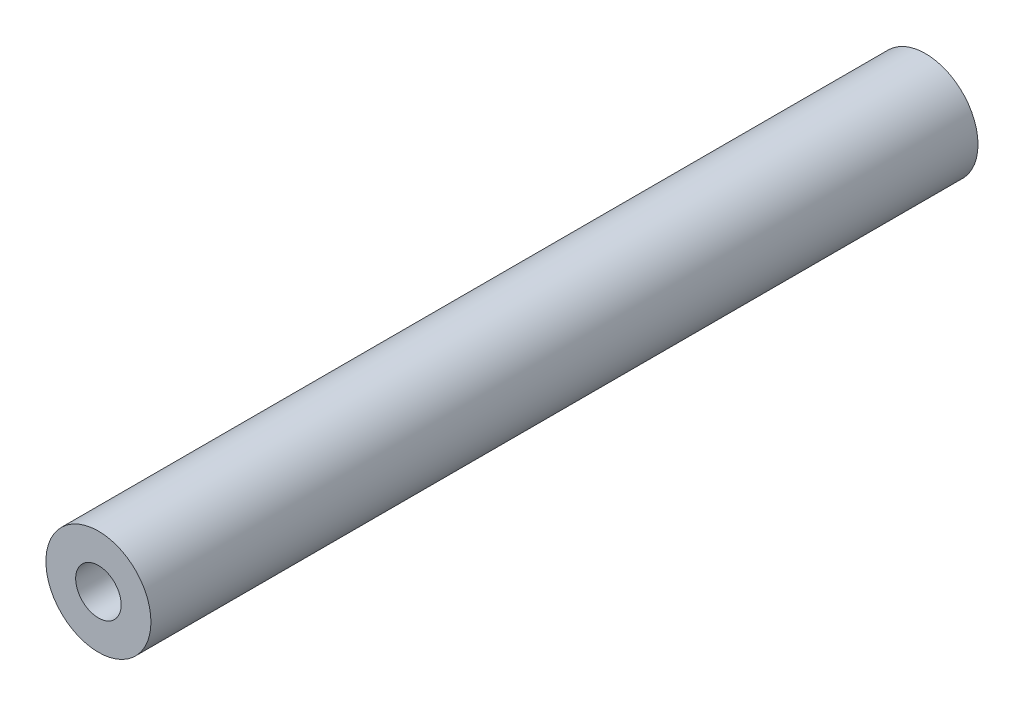
from build123d import *

# Parameters (mm, degrees)
SCHIZZO1_R                = 1.5875
SCHIZZO1_R_2              = 0.6875
ESTRUSIONE_SOTTILE1_DEPTH = 25


with BuildPart() as part:
    # Schizzo1 → Estrusione-Sottile1 (new body)
    with BuildSketch(Plane.XY):
        Circle(SCHIZZO1_R)
        Circle(SCHIZZO1_R_2, mode=Mode.SUBTRACT)
    extrude(amount=ESTRUSIONE_SOTTILE1_DEPTH)


solid = part.part
